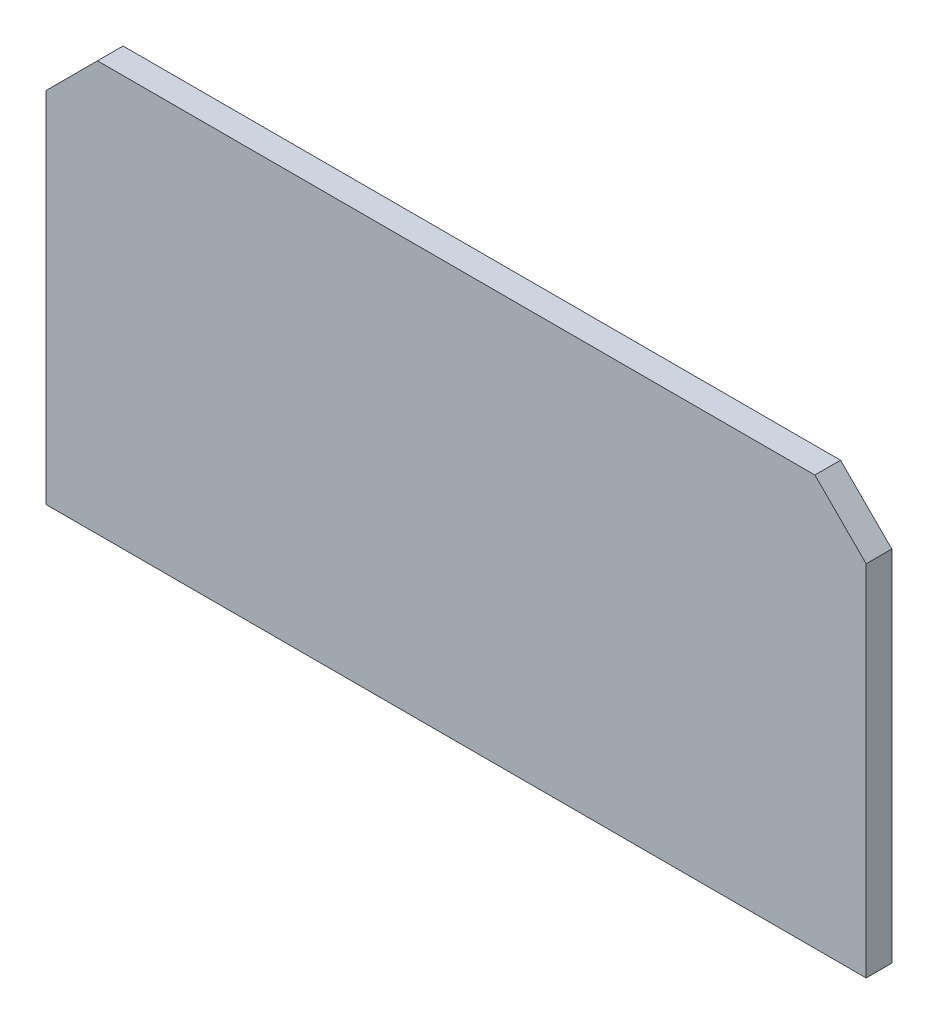
from build123d import *

# Parameters (mm, degrees)
EXTRUDE10_DEPTH = 3.175


with BuildPart() as part:
    # Sketch15 → Extrude10 (new body)
    with BuildSketch(Plane.XY):
        Polygon((0, 44.45), (6.35, 50.8), (95.25, 50.8), (101.6, 44.45), (101.6, 0), (0, 0), align=None)
    extrude(amount=-EXTRUDE10_DEPTH)


solid = part.part
